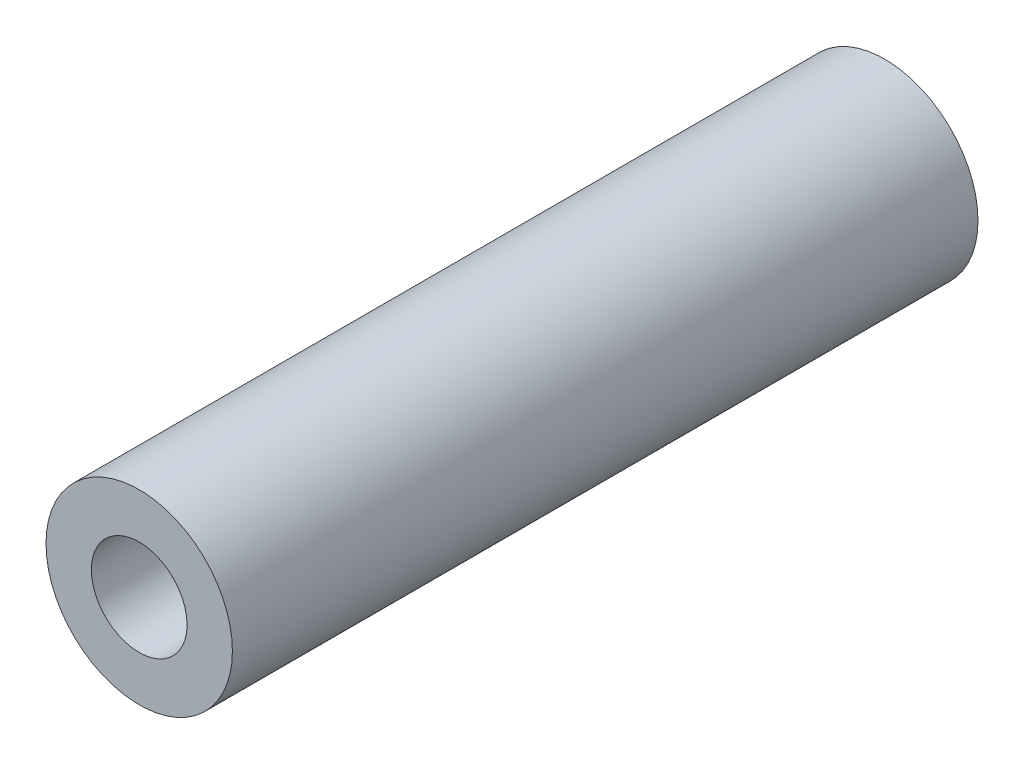
from build123d import *

# Parameters (mm, degrees)
SKETCH1_R      = 9.525
SKETCH1_R_2    = 4.8895
EXTRUDE1_DEPTH = 38.1


with BuildPart() as part:
    # Sketch1 → Extrude1 (new, symmetric)
    with BuildSketch(Plane.XY):
        with Locations(Location((0, 0, 0), (0, 0, 180))):
            Circle(SKETCH1_R)
        with Locations(Location((0, 0, 0), (0, 0, 180))):
            Circle(SKETCH1_R_2, mode=Mode.SUBTRACT)
    extrude(amount=EXTRUDE1_DEPTH, both=True)


solid = part.part
